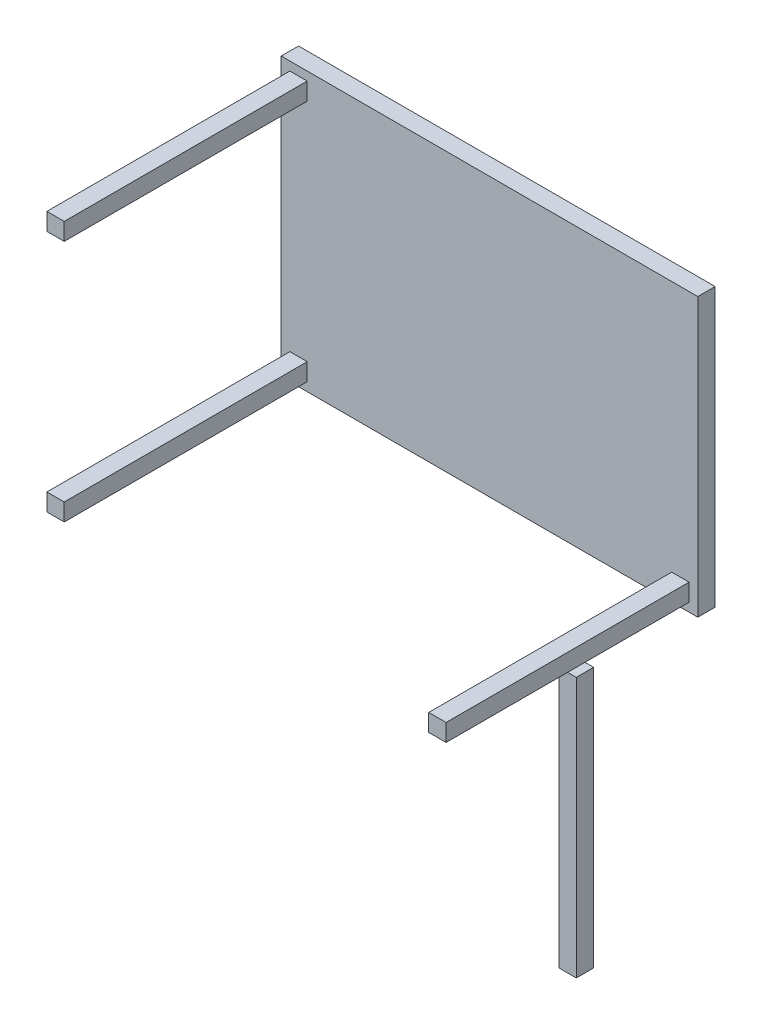
from build123d import *

# Parameters (mm, degrees)
SKETCH_1_W      = 1200
SKETCH_1_H      = 800
EXTRUDE_1_DEPTH = 50
SKETCH_2_W      = 50
SKETCH_2_H      = 50
EXTRUDE_2_DEPTH = 750
SKETCH_3_W      = 50
SKETCH_3_H      = 50
EXTRUDE_3_DEPTH = 750
SKETCH_4_W      = 50
SKETCH_4_H      = 50
EXTRUDE_4_DEPTH = 750
SKETCH_5_W      = 50
SKETCH_5_H      = 50
EXTRUDE_5_DEPTH = 750


with BuildPart() as part:
    # 草图1 → 凸台-拉伸1 (new body)
    with BuildSketch(Plane.XY):
        Rectangle(SKETCH_1_W, SKETCH_1_H)
    extrude(amount=EXTRUDE_1_DEPTH)

    # 草图3 → 凸台-拉伸3 (add)
    with BuildSketch(Plane.XY):
        with Locations((-550, 350)):
            Rectangle(SKETCH_3_W, SKETCH_3_H)
    extrude(amount=EXTRUDE_3_DEPTH)

    # 草图4 → 凸台-拉伸4 (add)
    with BuildSketch(Plane.XY):
        with Locations((550, -350)):
            Rectangle(SKETCH_4_W, SKETCH_4_H)
    extrude(amount=EXTRUDE_4_DEPTH)

    # 草图5 → 凸台-拉伸5 (add)
    with BuildSketch(Plane.XY):
        with Locations((-550, -350)):
            Rectangle(SKETCH_5_W, SKETCH_5_H)
    extrude(amount=EXTRUDE_5_DEPTH)


with BuildPart() as body_2:
    # 草图2 → 凸台-拉伸2 (new body)
    with BuildSketch(Plane.XZ.offset(400)):
        with Locations((550, 350)):
            Rectangle(SKETCH_2_W, SKETCH_2_H)
    extrude(amount=EXTRUDE_2_DEPTH)


solid = Compound([part.part, body_2.part])
